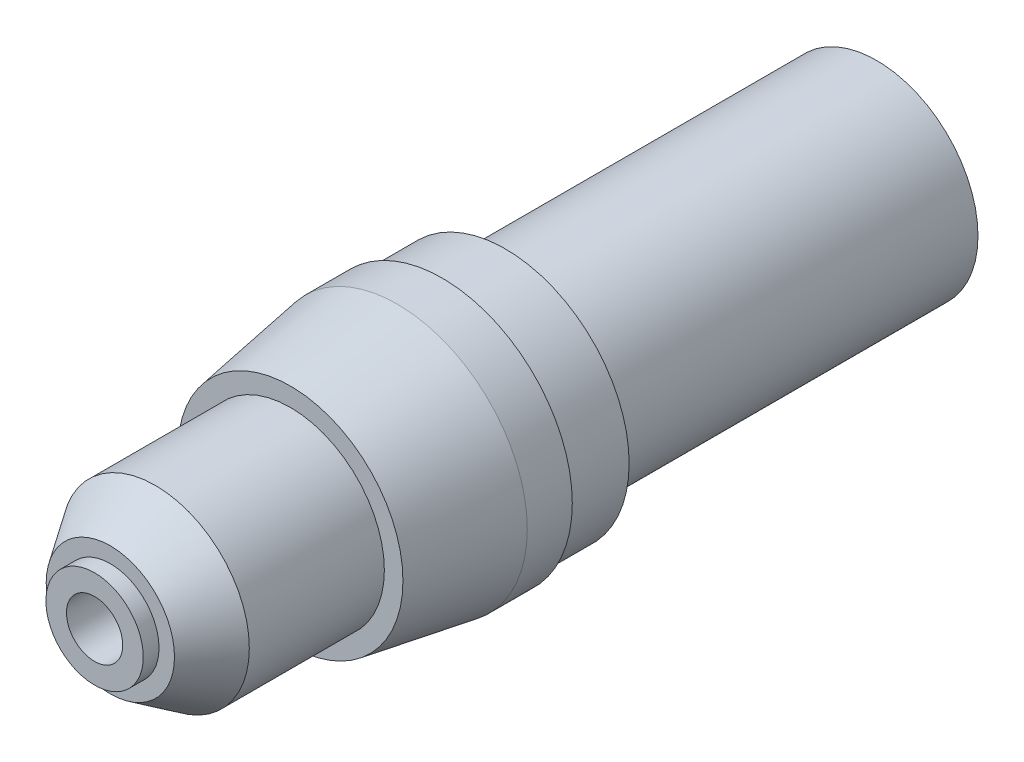
from build123d import *

# Parameters (mm, degrees)
SKETCH2_R           = 22.86
BOSS_EXTRUDE1_DEPTH = 83.82
SKETCH3_R           = 27.94
BOSS_EXTRUDE2_DEPTH = 14.224
SKETCH4_R           = 7.493
BOSS_EXTRUDE3_DEPTH = 4.445
SKETCH5_R           = 29.337
BOSS_EXTRUDE4_DEPTH = 10.16
SKETCH6_R           = 25.4
BOSS_EXTRUDE5_DEPTH = 24.13
SKETCH7_R           = 21.209
BOSS_EXTRUDE6_DEPTH = 30.48
SKETCH8_R           = 14.478
BOSS_EXTRUDE7_DEPTH = 10.16
SKETCH9_R           = 10.9855
BOSS_EXTRUDE8_DEPTH = 3.556
SKETCH10_R          = 6.35
CUT_EXTRUDE1_DEPTH  = 25.4


with BuildPart() as part:
    # Sketch2 → Boss-Extrude1 (new body)
    with BuildSketch(Plane.XY):
        Circle(SKETCH2_R)
    extrude(amount=BOSS_EXTRUDE1_DEPTH)

    # Sketch3 → Boss-Extrude2 (add)
    with BuildSketch(Plane.XY.offset(83.82)):
        Circle(SKETCH3_R)
    extrude(amount=BOSS_EXTRUDE2_DEPTH)

    # Sketch4 → Boss-Extrude3 (add)
    with BuildSketch(Plane(origin=(0, 0, 0), x_dir=(-1, 0, 0), z_dir=(0, 0, -1))):
        Circle(SKETCH4_R)
    extrude(amount=BOSS_EXTRUDE3_DEPTH)

    # Sketch5 → Boss-Extrude4 (add)
    with BuildSketch(Plane.XY.offset(98.044)):
        Circle(SKETCH5_R)
    extrude(amount=BOSS_EXTRUDE4_DEPTH)

    # Sketch6 → Boss-Extrude5 (add)
    with BuildSketch(Plane.XY.offset(108.204)):
        with Locations(Location((0, 0, 0), (0, 0, 180))):
            Circle(SKETCH6_R)
    extrude(amount=BOSS_EXTRUDE5_DEPTH)

    # loft up to a face of the part (loft1)
    loft([Face(Wire([part.edges().sort_by_distance((-20.082558447, 21.385752623, 108.204))[0]])), Face(Wire([part.edges().sort_by_distance((17.387496491, -18.515803137, 132.334))[0]]))])

    # Sketch7 → Boss-Extrude6 (add)
    with BuildSketch(Plane.XY.offset(132.334)):
        with Locations(Location((0, 0, 0), (0, 0, 180))):
            Circle(SKETCH7_R)
    extrude(amount=BOSS_EXTRUDE6_DEPTH)

    # Sketch8 → Boss-Extrude7 (add)
    with BuildSketch(Plane.XY.offset(162.814)):
        Circle(SKETCH8_R)
    extrude(amount=BOSS_EXTRUDE7_DEPTH)

    # Sketch9 → Boss-Extrude8 (add)
    with BuildSketch(Plane.XY.offset(172.974)):
        Circle(SKETCH9_R)
    extrude(amount=BOSS_EXTRUDE8_DEPTH)

    # loft up to a face of the part (loft2)
    loft([Face(Wire([part.edges().sort_by_distance((14.51855957, -15.460695619, 162.814))[0]])), Face(Wire([part.edges().sort_by_distance((-9.910873, 10.554007788, 172.974))[0]]))])

    # Sketch10 → Cut-Extrude1 (cut)
    with BuildSketch(Plane.XY.offset(176.53)):
        Circle(SKETCH10_R)
    extrude(amount=-CUT_EXTRUDE1_DEPTH, mode=Mode.SUBTRACT)


solid = part.part
